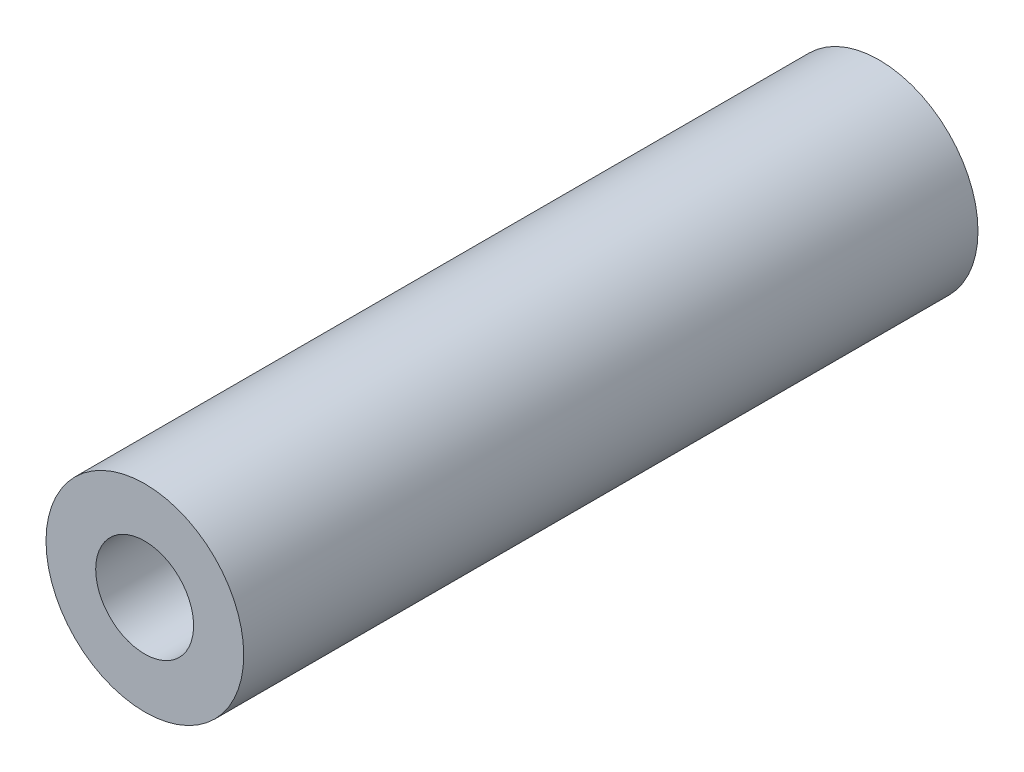
from build123d import *

# Parameters (mm, degrees)
ESQUISSE1_R        = 6.059227443
ESQUISSE1_R_2      = 3
BOSS_EXTRU_1_DEPTH = 45


with BuildPart() as part:
    # Esquisse1 → Boss.-Extru.1 (new body)
    with BuildSketch(Plane.XY):
        with Locations(Location((-0.109403062, 0.057745212, 0), (0, 0, 180))):
            Circle(ESQUISSE1_R)
        with Locations(Location((-0.123031065, 0.076111171, 0), (0, 0, 180))):
            Circle(ESQUISSE1_R_2, mode=Mode.SUBTRACT)
    extrude(amount=BOSS_EXTRU_1_DEPTH)


solid = part.part
